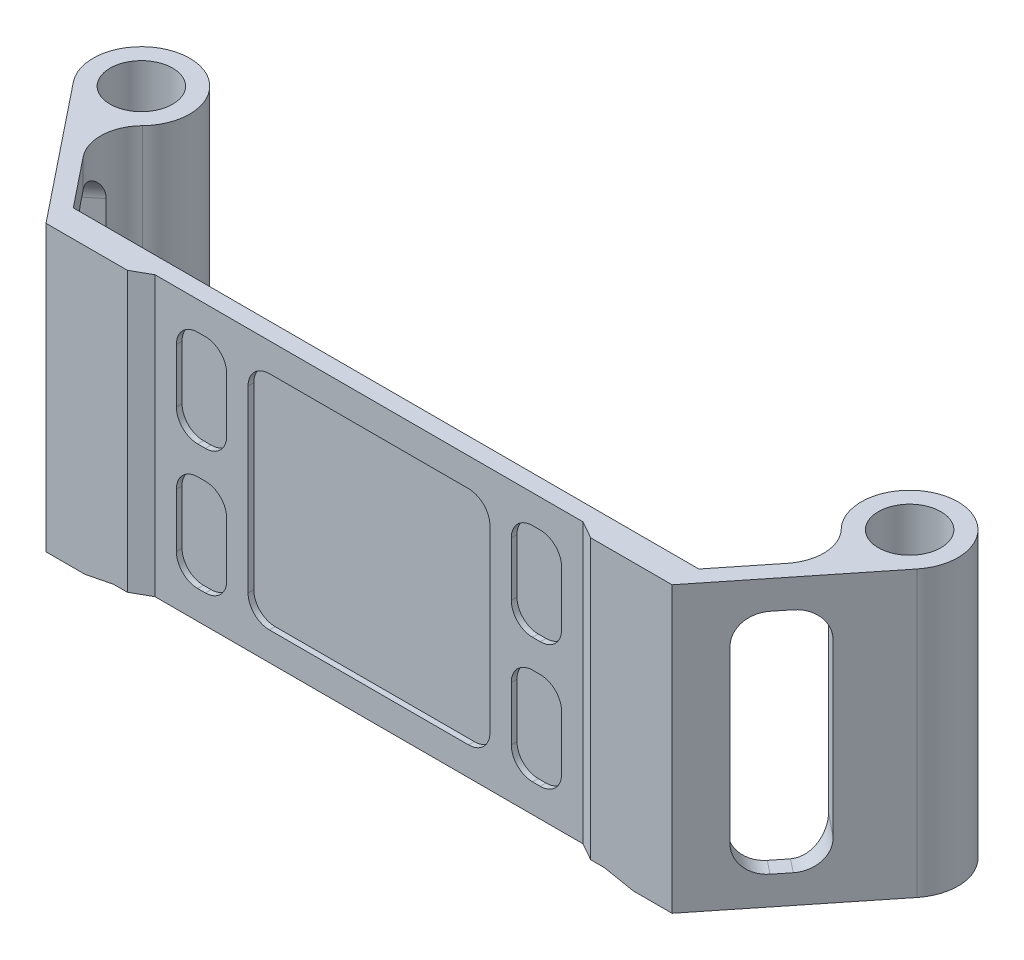
from build123d import *

# Parameters (mm, degrees)
SKETCH_1_R               = 2.2
EXTRUDE_1_DEPTH          = 20
FILLET_1_R               = 3
SKETCH_3_W               = 5.163325916
SKETCH_3_H               = 16.003609002
CUT_EXTRUDE_2_DEPTH      = 57.596101085
FILLET_2_R               = 2
EXTRUDE_2_DEPTH          = 20
CUT_EXTRUDE_1_DEPTH      = 40.134639439
CUT_EXTRUDE_1_DEPTH_BACK = 40.134639439
SKETCH_5_W               = 17
SKETCH_5_H               = 15.6
SKETCH_5_W_2             = 3.540430575
SKETCH_5_H_2             = 6.8
CUT_EXTRUDE_3_DEPTH      = 0.4
FILLET_3_R               = 1.5


with BuildPart() as part:
    # 草图1 → 凸台-拉伸1 (new body)
    with BuildSketch(Plane(origin=(0, 0, 0), x_dir=(1, 0, 0), z_dir=(0, 1, 0))):
        with BuildLine():
            Line((-29.65627848, -2.122306442), (-22.56320207, -11))
            Line((-22.56320207, -11), (22.56320207, -11))
            Line((22.56320207, -11), (29.65627848, -2.122306442))
            ThreePointArc((29.65627848, -2.122306442), (25.48101359, 3.04182187), (27.10063693, -3.398510293))
            Line((27.10063693, -3.398510293), (21.985991405, -9.8))
            Line((21.985991405, -9.8), (-21.985991405, -9.8))
            Line((-21.985991405, -9.8), (-27.10063693, -3.398510293))
            ThreePointArc((-27.10063693, -3.398510293), (-25.48101359, 3.04182187), (-29.65627848, -2.122306442))
        make_face()
        with Locations(Location((-27, 0, 0), (0, 0, 270))):
            Circle(SKETCH_1_R, mode=Mode.SUBTRACT)
        with Locations(Location((27, 0, 0), (0, 0, 90))):
            Circle(SKETCH_1_R, mode=Mode.SUBTRACT)
    extrude(amount=EXTRUDE_1_DEPTH)

    # 圆角1
    fillet_1_edges = [part.edges().sort_by_distance(p)[0] for p in [
        (-27.10063693, 10, 3.398510293),
        (27.10063693, 10, 3.398510293),
    ]]
    fillet(fillet_1_edges, radius=FILLET_1_R)

    # 草图3 → 切除-拉伸2 (cut, through all)
    with BuildSketch(Plane(origin=(19.136124058, 0, 15.289330416), x_dir=(0.6242077770989366, 0, -0.7812583766009837), z_dir=(0.7812583766009837, 0, 0.6242077770989366))):
        with Locations((10.071947024, 9.998195499)):
            Rectangle(SKETCH_3_W, SKETCH_3_H)
    cut_extrude_2 = extrude(amount=-CUT_EXTRUDE_2_DEPTH, mode=Mode.SUBTRACT)

    # 镜向1: 切除-拉伸2 across plane
    add(cut_extrude_2.mirror(Plane(origin=(0, 0, 0), x_dir=(0, 0, 1), z_dir=(1, 0, 0))), mode=Mode.SUBTRACT)

    # 圆角2
    fillet_2_edges = [part.edges().sort_by_distance(p)[0] for p in [
        (23.342862598, 1.996390998, 9.062958581),
        (26.211335217, 18, 4.745817031),
        (26.211335217, 1.996390998, 4.745817031),
        (23.342862598, 18, 9.062958581),
        (-23.342862598, 18, 9.062958581),
        (-26.211335217, 1.996390998, 4.745817031),
        (-26.211335217, 18, 4.745817031),
        (-23.342862598, 1.996390998, 9.062958581),
    ]]
    fillet(fillet_2_edges, radius=FILLET_2_R)

    # 草图4 → 凸台-拉伸2 (add)
    with BuildSketch(Plane(origin=(0, 20, 0), x_dir=(1, 0, 0), z_dir=(0, 1, 0))):
        Polygon((-22.56320207, -11), (-22.003917898, -11.7), (-16.284224925, -11.7), (-15.040430575, -11), align=None)
        Polygon((15.040430575, -11), (22.56320207, -11), (22.003917898, -11.7), (16.284224925, -11.7), align=None)
    extrude(amount=-EXTRUDE_2_DEPTH)

    # 草图2 → 切除-拉伸1 (cut, two sides: drawn at the far end of the back side and taken through both)
    with BuildSketch(Plane.XY.offset(11).offset(-CUT_EXTRUDE_1_DEPTH_BACK)):
        Polygon((-19.273176969, 0), (-17.2479344, 0.4), (17.2479344, 0.4), (19.273176969, 0), align=None)
    extrude(amount=CUT_EXTRUDE_1_DEPTH + CUT_EXTRUDE_1_DEPTH_BACK, mode=Mode.SUBTRACT)

    # 草图5 → 切除-拉伸3 (cut)
    with BuildSketch(Plane.XY.offset(11)):
        with Locations((0, 10.2)):
            Rectangle(SKETCH_5_W, SKETCH_5_H)
        with Locations((-11.770215288, 14.6)):
            Rectangle(SKETCH_5_W_2, SKETCH_5_H_2)
        with Locations((11.770215288, 14.6)):
            Rectangle(SKETCH_5_W_2, SKETCH_5_H_2)
        with Locations((-11.770215288, 5.8)):
            Rectangle(SKETCH_5_W_2, SKETCH_5_H_2)
        with Locations((11.770215288, 5.8)):
            Rectangle(SKETCH_5_W_2, SKETCH_5_H_2)
    extrude(amount=-CUT_EXTRUDE_3_DEPTH, mode=Mode.SUBTRACT)

    # 圆角3
    fillet_3_edges = [part.edges().sort_by_distance(p)[0] for p in [
        (13.540430575, 2.4, 10.8),
        (10, 2.4, 10.8),
        (10, 9.2, 10.8),
        (13.540430575, 9.2, 10.8),
        (-13.540430575, 2.4, 10.8),
        (-13.540430575, 9.2, 10.8),
        (-10, 9.2, 10.8),
        (-10, 2.4, 10.8),
        (13.540430575, 18, 10.8),
        (13.540430575, 11.2, 10.8),
        (10, 11.2, 10.8),
        (10, 18, 10.8),
        (-10, 18, 10.8),
        (-10, 11.2, 10.8),
        (-13.540430575, 11.2, 10.8),
        (-13.540430575, 18, 10.8),
        (8.5, 18, 10.8),
        (8.5, 2.4, 10.8),
        (-8.5, 2.4, 10.8),
        (-8.5, 18, 10.8),
    ]]
    fillet(fillet_3_edges, radius=FILLET_3_R)


solid = part.part
